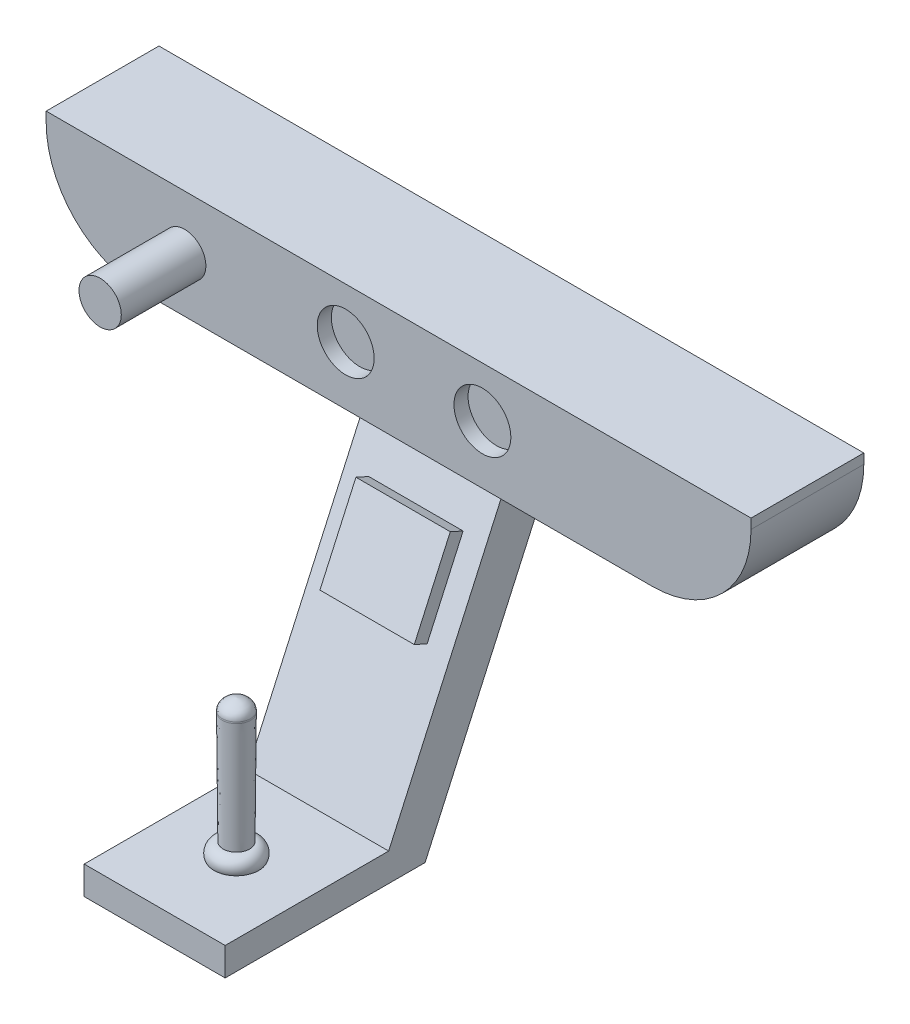
from build123d import *

# Parameters (mm, degrees)
BOSS_EXTRUDE1_DEPTH = 8
SKETCH2_R           = 1.5
BOSS_EXTRUDE2_DEPTH = 6
BOSS_EXTRUDE3_DEPTH = 5
SKETCH6_W           = 6.69152868
SKETCH6_H           = 6.205945627
BOSS_EXTRUDE6_DEPTH = 1
SKETCH7_R           = 2.018356376
CUT_EXTRUDE1_DEPTH  = 1


with BuildPart() as part:
    # Sketch1 → Boss-Extrude1 (new body)
    with BuildSketch(Plane.XY):
        with BuildLine():
            Line((-26.903550099, 0), (23.096449901, 0))
            Line((23.096449901, 0), (23.096449901, -0.7))
            ThreePointArc((23.096449901, -0.7), (21.046197369, -5.649747468), (16.096449901, -7.7))
            Line((16.096449901, -7.7), (-19.903550099, -7.7))
            ThreePointArc((-19.903550099, -7.7), (-24.853297568, -5.649747468), (-26.903550099, -0.7))
            Line((-26.903550099, -0.7), (-26.903550099, 0))
        make_face()
    extrude(amount=BOSS_EXTRUDE1_DEPTH)

    # Sketch2 → Boss-Extrude2 (add)
    with BuildSketch(Plane.XY.offset(8)):
        with Locations((-17.076235964, -3.85)):
            Circle(SKETCH2_R)
    extrude(amount=BOSS_EXTRUDE2_DEPTH)

    # Sketch3 → Boss-Extrude3 (add, symmetric)
    with BuildSketch(Plane(origin=(0, 0, 0), x_dir=(0, 0, -1), z_dir=(1, 0, 0))):
        Polygon((-4, -7.7), (-13.024577684, -27.7), (-25.024577684, -27.7), (-27.207163102, -27.7), (-27.207163102, -25.7), (-25.024577684, -25.7), (-15.609285193, -25.7), (-7.487165278, -7.7), align=None)
    extrude(amount=BOSS_EXTRUDE3_DEPTH, both=True)

    # Sketch6 → Boss-Extrude6 (add)
    with BuildSketch(Plane(origin=(0, 1.504350405, 3.333896515), x_dir=(1, 0, 0), z_dir=(0, 0.411295964451016, 0.911501853879798))):
        with Locations((0, -16.088463414)):
            Rectangle(SKETCH6_W, SKETCH6_H)
    extrude(amount=BOSS_EXTRUDE6_DEPTH)

    # Sketch7 → Cut-Extrude1 (cut)
    with BuildSketch(Plane.XY.offset(8)):
        with Locations((-5.657616705, -3.562287369)):
            Circle(SKETCH7_R)
        with Locations((4.040388693, -3.562287369)):
            Circle(SKETCH7_R)
    extrude(amount=-CUT_EXTRUDE1_DEPTH, mode=Mode.SUBTRACT)

    # Sketch10 → Revolve2 (revolve)
    with BuildSketch(Plane(origin=(0, 0, 0), x_dir=(0, 0, -1), z_dir=(1, 0, 0)), mode=Mode.PRIVATE) as revolve2_sk:
        with BuildLine():
            Line((-22.996998778, -25.7), (-21.408224147, -25.7))
            Line((-21.408224147, -25.7), (-21.408224147, -15.873742871))
            add(Edge.make_bspline(
                [(-21.408224147, -15.873742871), (-22.370300932, -16.046682358), (-22.408224147, -16.666364236)],
                knots=[0, 0, 0, 0.92415357, 0.92415357, 0.92415357], degree=2))
            Line((-22.408224147, -16.666364236), (-22.408224147, -16.771089476))
            Line((-22.408224147, -16.771089476), (-22.342150898, -24.712427098))
            ThreePointArc((-22.342150898, -24.712427098), (-22.931989874, -25.03220925), (-22.996998778, -25.7))
        make_face()
    revolve(revolve2_sk.sketch.rotate(Axis((0, -25.7, 21.408224147), (0, 1, 0)), 180), axis=Axis((0, -25.7, 21.408224147), (0, 1, 0)))


solid = part.part
